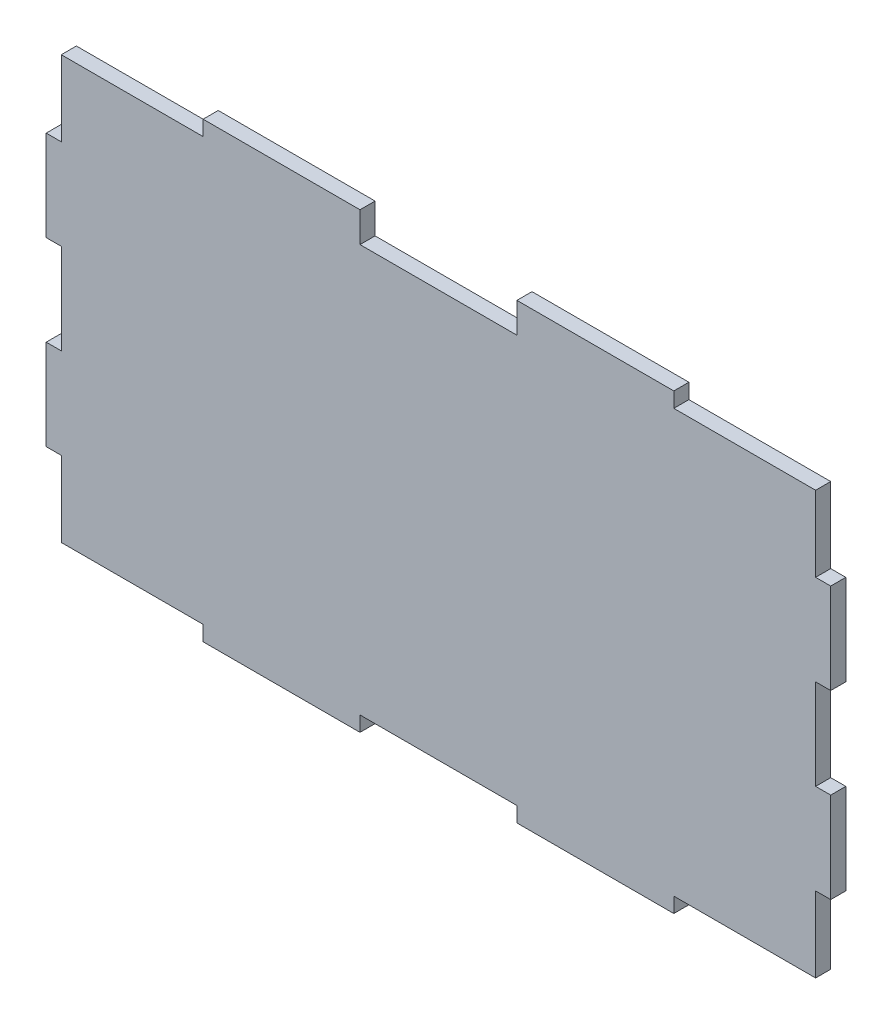
from build123d import *

# Parameters (mm, degrees)
SALIENTE_EXTRUIR1_DEPTH = 5
CROQUIS2_W              = 52
CROQUIS2_H              = 5
CORTAR_EXTRUIR1_DEPTH   = 10


with BuildPart() as part:
    # Croquis1 → Saliente-Extruir1 (new body)
    with BuildSketch(Plane.XY):
        Polygon((52, 0), (104, 0), (104, 5), (156, 5), (156, 0), (208, 0), (208, 5), (255, 5), (255, 30), (260, 30), (260, 60), (255, 60), (255, 90), (260, 90), (260, 120), (255, 120), (255, 145), (208, 145), (208, 150), (156, 150), (156, 145), (104, 145), (104, 150), (52, 150), (52, 145), (5, 145), (5, 120), (0, 120), (0, 90), (5, 90), (5, 60), (0, 60), (0, 30), (5, 30), (5, 5), (52, 5), align=None)
    extrude(amount=SALIENTE_EXTRUIR1_DEPTH)

    # Croquis2 → Cortar-Extruir1 (cut)
    with BuildSketch(Plane.XY.offset(5)):
        with Locations((130, 142.5)):
            Rectangle(CROQUIS2_W, CROQUIS2_H)
    extrude(amount=-CORTAR_EXTRUIR1_DEPTH, mode=Mode.SUBTRACT)


solid = part.part
